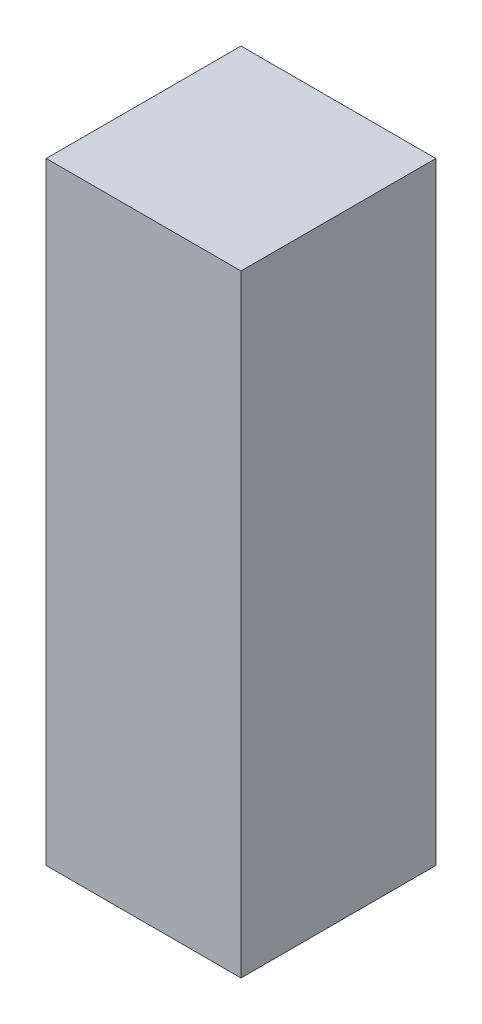
from build123d import *

# Parameters (mm, degrees)
SKETCH_1_W      = 0.7
SKETCH_1_H      = 0.7
EXTRUDE_1_DEPTH = 2.2


with BuildPart() as part:
    # 草图1 → 凸台-拉伸1 (new body)
    with BuildSketch(Plane(origin=(0, 0, 0), x_dir=(1, 0, 0), z_dir=(0, 1, 0))):
        Rectangle(SKETCH_1_W, SKETCH_1_H)
    extrude(amount=EXTRUDE_1_DEPTH)


solid = part.part
